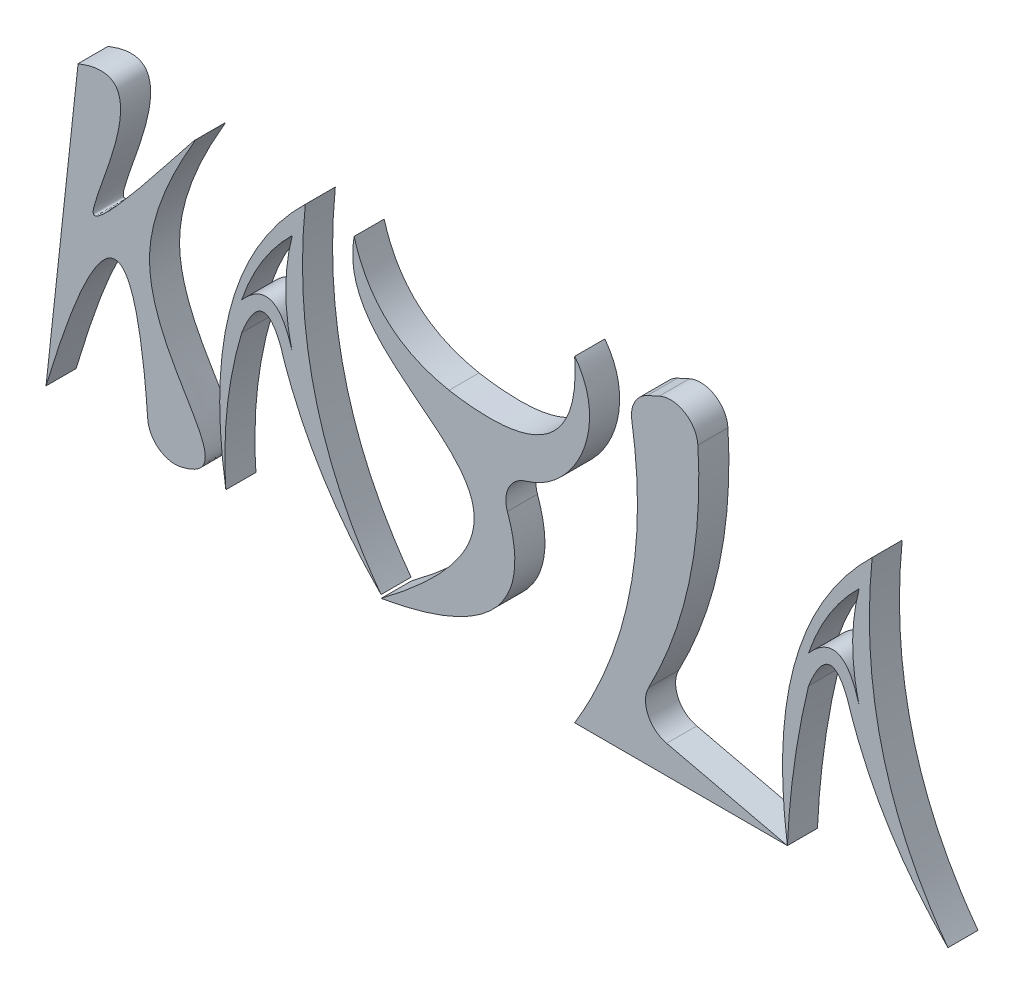
from build123d import *

# Parameters (mm, degrees)
BOSS_EXTRUDE7_DEPTH   = 8.382
BOSS_EXTRUDE7_2_DEPTH = 8.382
BOSS_EXTRUDE7_3_DEPTH = 8.382
BOSS_EXTRUDE7_4_DEPTH = 8.382
BOSS_EXTRUDE7_5_DEPTH = 8.382
FILLET1_R             = 7.62
FILLET2_R             = 7.62
FILLET3_R             = 7.62


with BuildPart() as part:
    # Sketch1 → Boss-Extrude7 (new body)
    with BuildSketch(Plane.XY):
        with BuildLine():
            add(Edge.make_bspline(
                [(80.593985758, -39.986212348), (104.590491263, -1.36618624), (98.15161207, 44.90200856)],
                knots=[0, 0, 0, 1, 1, 1], degree=2))
            Line((98.15161207, 44.90200856), (79.812036694, 36.499144996))
            add(Edge.make_bspline(
                [(79.812036694, 36.499144996), (89.154447315, -9.795856584), (64.913873917, -50.1734664)],
                knots=[0, 0, 0, 1, 1, 1], degree=2))
            Line((64.913873917, -50.1734664), (124.199759198, -50.183766386))
            Line((124.199759198, -50.183766386), (80.593985758, -39.986212348))
        make_face()
    extrude(amount=BOSS_EXTRUDE7_DEPTH)

    # Fillet1
    fillet1_edges = [part.edges().sort_by_distance(p)[0] for p in [
        (80.593985758, -39.986212348, 4.191),
        (79.812036694, 36.499144996, 4.191),
        (98.15161207, 44.90200856, 4.191),
    ]]
    fillet(fillet1_edges, radius=FILLET1_R)


with BuildPart() as body_2:
    # Sketch1 → Boss-Extrude7 2 (new body)
    with BuildSketch(Plane.XY):
        with BuildLine():
            add(Edge.make_bspline(
                [(124.199759198, -50.183766386), (117.012925983, 1.129181269), (147.820432676, 31.186409083)],
                knots=[0, 0, 0, 1, 1, 1], degree=2))
            add(Edge.make_bspline(
                [(130.094029688, -8.672052455), (125.153114682, -29.161062657), (124.199759198, -50.183766386)],
                knots=[0, 0, 0, 1, 1, 1], degree=2))
            add(Edge.make_bspline(
                [(140.867171715, -6.244774349), (135.954892962, 6.033440127), (130.094029688, -8.672052455)],
                knots=[0, 0, 0, 1, 1, 1], degree=2))
            add(Edge.make_bspline(
                [(168.945677423, -52.450314734), (149.01592665, -32.325741622), (140.867171715, -6.244774349)],
                knots=[0, 0, 0, 1, 1, 1], degree=2))
            add(Edge.make_bspline(
                [(147.820432676, 31.186409083), (142.934936535, -17.333599118), (168.945677423, -52.450314734)],
                knots=[0, 0, 0, 1, 1, 1], degree=2))
        make_face()
        with BuildLine():
            add(Edge.make_bspline(
                [(144.205094278, 21.870592822), (140.568342388, 7.735944588), (144.205095137, -6.244774401)],
                knots=[0, 0, 0, 1, 1, 1], degree=2))
            add(Edge.make_bspline(
                [(144.205095137, -6.244774401), (139.590870199, 9.890356254), (130.094029961, -0.751460023)],
                knots=[0, 0, 0, 1, 1, 1], degree=2))
            add(Edge.make_bspline(
                [(130.094029961, -0.751460023), (134.577438531, 12.450294456), (144.205094278, 21.870592822)],
                knots=[0, 0, 0, 1, 1, 1], degree=2))
        make_face(mode=Mode.SUBTRACT)
    extrude(amount=BOSS_EXTRUDE7_2_DEPTH)


with BuildPart() as body_3:
    # Sketch1 → Boss-Extrude7 3 (new body)
    with BuildSketch(Plane.XY):
        with BuildLine():
            add(Edge.make_bspline(
                [(-73.501404724, 39.730710138), (-48.4925566, 49.519454353), (-92.646020123, -31.016507841), (-23.071407093, 62.195978495), (-76.266965034, -13.16034631), (-17.987425724, -42.603241217), (-53.572173938, -44.329763315)],
                knots=[0, 0, 0, 0, 0.243395444, 0.47314994, 0.666139964, 1, 1, 1, 1], degree=3))
            Line((-73.501404724, 39.730710138), (-82.444007756, -42.541242581))
            add(Edge.make_bspline(
                [(-82.444007756, -42.541242581), (-58.114713757, 38.651120963), (-53.572173938, -44.329763315)],
                knots=[0, 0, 0, 1, 1, 1], degree=2))
        make_face()
    extrude(amount=BOSS_EXTRUDE7_3_DEPTH)

    # Fillet3
    fillet3_edges = [body_3.edges().sort_by_distance(p)[0] for p in [
        (-53.572173938, -44.329763315, 4.191),
    ]]
    fillet(fillet3_edges, radius=FILLET3_R)


with BuildPart() as body_4:
    # Sketch1 → Boss-Extrude7 4 (new body)
    with BuildSketch(Plane.XY):
        with BuildLine():
            add(Edge.make_bspline(
                [(-32.314181698, -42.541242543), (-40.426407552, 8.00029759), (-10.180115619, 37.43118326)],
                knots=[0, 0, 0, 1, 1, 1], degree=2))
            add(Edge.make_bspline(
                [(-27.906518833, -2.427278118), (-33.756676706, -22.153382102), (-32.314181698, -42.541242543)],
                knots=[0, 0, 0, 1, 1, 1], degree=2))
            add(Edge.make_bspline(
                [(-17.133376776, -1.24e-07), (-22.045655474, 12.278214596), (-27.906518833, -2.427278118)],
                knots=[0, 0, 0, 1, 1, 1], degree=2))
            add(Edge.make_bspline(
                [(10.945127821, -46.205541186), (-8.98462146, -26.080967176), (-17.133376776, -1.24e-07)],
                knots=[0, 0, 0, 1, 1, 1], degree=2))
            add(Edge.make_bspline(
                [(-10.180115619, 37.43118326), (-15.065602355, -11.08881845), (10.945127821, -46.205541186)],
                knots=[0, 0, 0, 1, 1, 1], degree=2))
        make_face()
        with BuildLine():
            add(Edge.make_bspline(
                [(-13.795454223, 28.115367177), (-17.432206261, 13.980718755), (-13.795453156, -3.62e-07)],
                knots=[0, 0, 0, 1, 1, 1], degree=2))
            add(Edge.make_bspline(
                [(-13.795453156, -3.62e-07), (-18.409678263, 16.13513086), (-27.906518828, 5.49331412)],
                knots=[0, 0, 0, 1, 1, 1], degree=2))
            add(Edge.make_bspline(
                [(-27.906518828, 5.49331412), (-23.42310895, 18.695067722), (-13.795454223, 28.115367177)],
                knots=[0, 0, 0, 1, 1, 1], degree=2))
        make_face(mode=Mode.SUBTRACT)
    extrude(amount=BOSS_EXTRUDE7_4_DEPTH)


with BuildPart() as body_5:
    # Sketch1 → Boss-Extrude7 5 (new body)
    with BuildSketch(Plane.XY):
        with BuildLine():
            add(Edge.make_bspline(
                [(29.890111286, 12.585029407), (9.05672741, 16.569741522), (3.43831823, 36.499146501)],
                knots=[0, 0, 0, 1, 1, 1], degree=2))
            add(Edge.make_bspline(
                [(3.43831823, 36.499146501), (-3.380877769, -0.911289563), (76.36846317, 2.076687962), (10.945127821, -47.137578729)],
                knots=[0, 0, 0, 0, 1, 1, 1, 1], degree=3))
            add(Edge.make_bspline(
                [(10.945127821, -47.137578729), (63.881678361, -37.878265116), (41.659633188, 1.054169954)],
                knots=[0, 0, 0, 1, 1, 1], degree=2))
            add(Edge.make_bspline(
                [(41.659633188, 1.054169954), (61.09208277, -3.235841598), (76.876091958, 22.943979497), (64.91387385, 38.287667017)],
                knots=[0, 0, 0, 0, 1, 1, 1, 1], degree=3))
            add(Edge.make_bspline(
                [(64.91387385, 38.287667017), (67.195593198, 6.196084158), (29.890111286, 12.585029407)],
                knots=[0, 0, 0, 1, 1, 1], degree=2))
        make_face()
    extrude(amount=BOSS_EXTRUDE7_5_DEPTH)

    # Fillet2
    fillet2_edges = [body_5.edges().sort_by_distance(p)[0] for p in [
        (41.659633188, 1.054169954, 4.191),
    ]]
    fillet(fillet2_edges, radius=FILLET2_R)


solid = Compound([part.part, body_2.part, body_3.part, body_4.part, body_5.part])
